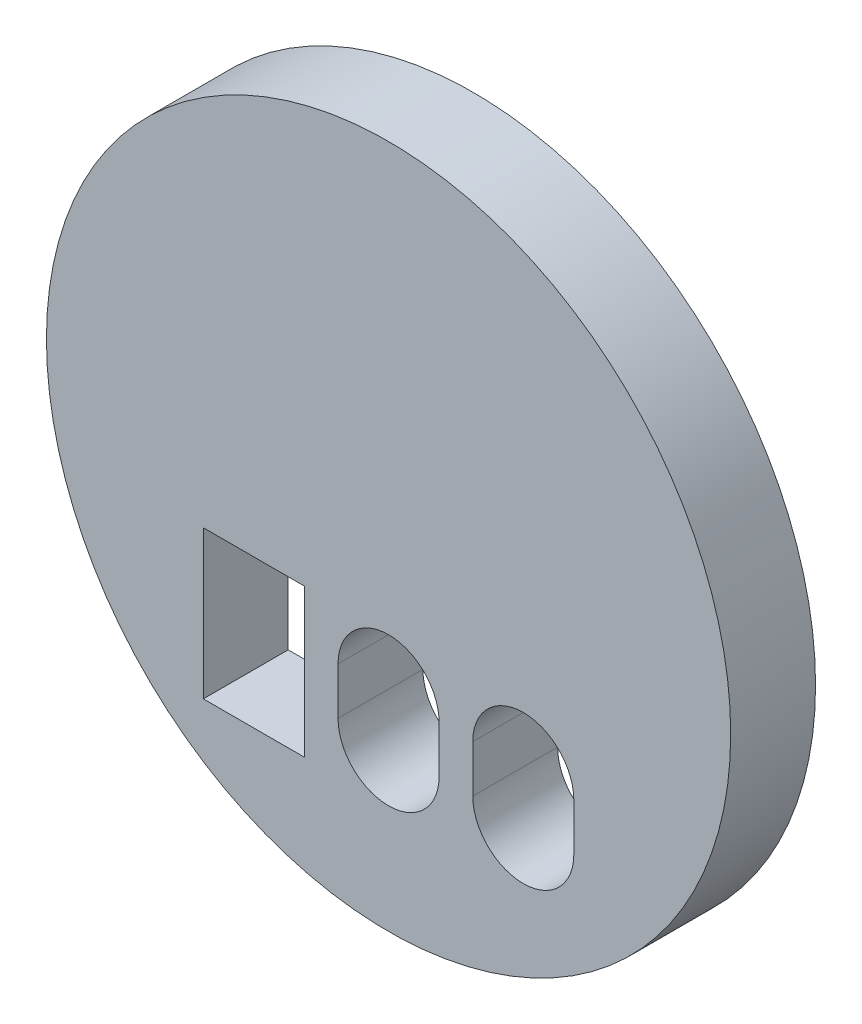
from build123d import *

# Parameters (mm, degrees)
MODEL_R            = 6.45
MODEL_W            = 1.905
MODEL_H            = 2.794
BOSS_EXTRU_1_DEPTH = 1.6


with BuildPart() as part:
    # Model → Boss.-Extru.1 (new body)
    with BuildSketch(Plane.XY):
        Circle(MODEL_R)
        with Locations((-2.54, -3)):
            Rectangle(MODEL_W, MODEL_H, mode=Mode.SUBTRACT)
        with BuildLine():
            Line((0.9525, -2.5555), (0.9525, -3.4445))
            ThreePointArc((0.9525, -3.4445), (0, -4.397), (-0.9525, -3.4445))
            Line((-0.9525, -3.4445), (-0.9525, -2.5555))
            ThreePointArc((-0.9525, -2.5555), (0, -1.603), (0.9525, -2.5555))
        make_face(mode=Mode.SUBTRACT)
        with BuildLine():
            Line((3.4925, -2.5555), (3.4925, -3.4445))
            ThreePointArc((3.4925, -3.4445), (2.54, -4.397), (1.5875, -3.4445))
            Line((1.5875, -3.4445), (1.5875, -2.5555))
            ThreePointArc((1.5875, -2.5555), (2.54, -1.603), (3.4925, -2.5555))
        make_face(mode=Mode.SUBTRACT)
    extrude(amount=BOSS_EXTRU_1_DEPTH)


solid = part.part
